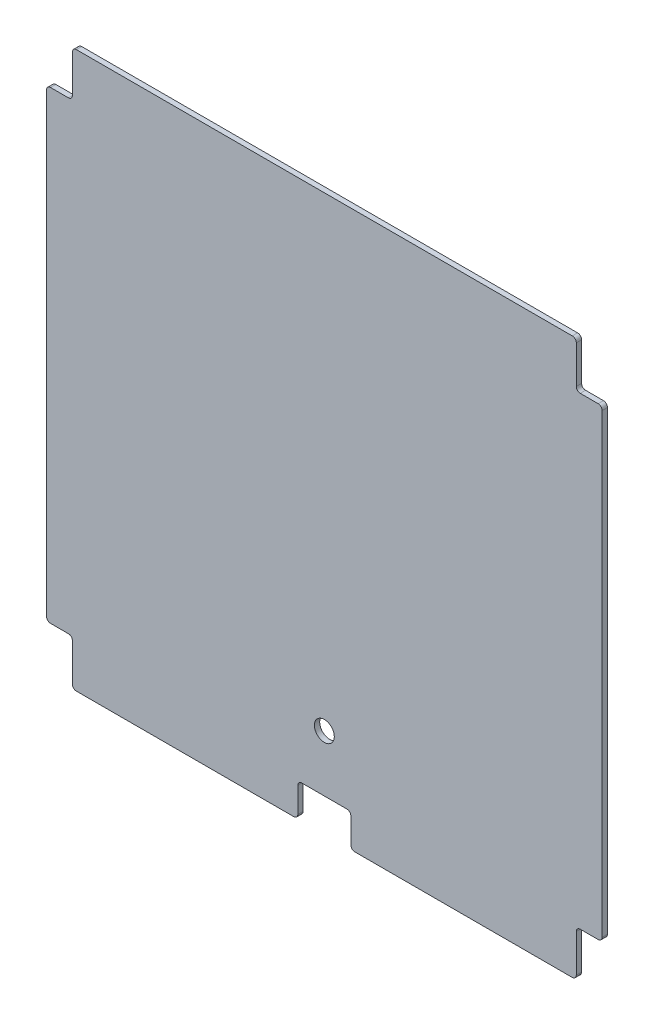
from build123d import *

# Parameters (mm, degrees)
SKETCH1_W           = 419
SKETCH1_H           = 419
BASE_SHEET_DEPTH    = 4
SKETCH2_W           = 19.5
SKETCH2_H           = 34.5
BELT_CUTOUTS_DEPTH  = 297.304741778
SKETCH3_R           = 7.5
SKETCH3_W           = 40
SKETCH3_H           = 25
CABLE_CUTOUTS_DEPTH = 4
FILLET1_R           = 3


with BuildPart() as part:
    # Sketch1 → base sheet (new body)
    with BuildSketch(Plane.XY):
        Rectangle(SKETCH1_W, SKETCH1_H)
    extrude(amount=BASE_SHEET_DEPTH)

    # Sketch2 → belt cutouts (cut, through all)
    with BuildSketch(Plane.XY.offset(4)):
        with Locations((-199.75, 192.25)):
            Rectangle(SKETCH2_W, SKETCH2_H)
        with Locations((199.75, 192.25)):
            Rectangle(SKETCH2_W, SKETCH2_H)
        with Locations((-199.75, -192.25)):
            Rectangle(SKETCH2_W, SKETCH2_H)
        with Locations((199.75, -192.25)):
            Rectangle(SKETCH2_W, SKETCH2_H)
    extrude(amount=-BELT_CUTOUTS_DEPTH, mode=Mode.SUBTRACT)

    # Sketch3 → cable cutouts (cut)
    with BuildSketch(Plane.XY.offset(4)):
        with Locations((0, -142)):
            Circle(SKETCH3_R)
        with Locations((0, -197)):
            Rectangle(SKETCH3_W, SKETCH3_H)
    extrude(amount=-CABLE_CUTOUTS_DEPTH, mode=Mode.SUBTRACT)

    # Fillet1
    fillet1_edges = [part.edges().sort_by_distance(p)[0] for p in [
        (209.5, 175, 2),
        (190, 175, 2),
        (190, 209.5, 2),
        (-209.5, -175, 2),
        (-190, -175, 2),
        (-190, -209.5, 2),
        (209.5, -175, 2),
        (190, -209.5, 2),
        (190, -175, 2),
        (-209.5, 175, 2),
        (-190, 209.5, 2),
        (-190, 175, 2),
        (-20, -209.5, 2),
        (-20, -184.5, 2),
        (20, -184.5, 2),
        (20, -209.5, 2),
    ]]
    fillet(fillet1_edges, radius=FILLET1_R)


solid = part.part
